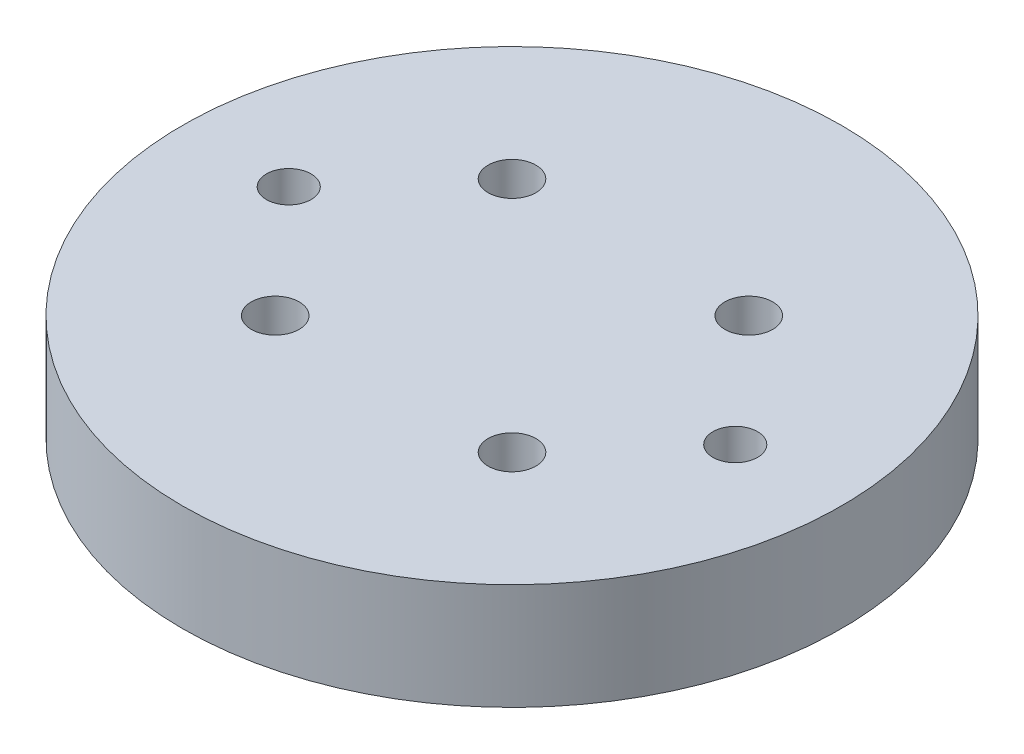
from build123d import *

# Parameters (mm, degrees)
SKETCH_1_R                = 31
EXTRUDE_1_DEPTH           = 10
HOLE_WIZARD_M5_2_D        = 4.2
HOLE_WIZARD_2_D           = 4.5
HOLE_WIZARD_2_CBORE_D     = 8
HOLE_WIZARD_2_CBORE_DEPTH = 4.6


with BuildPart() as part:
    # 草图1 → 凸台-拉伸1 (new body)
    with BuildSketch(Plane(origin=(0, 0, 0), x_dir=(1, 0, 0), z_dir=(0, 1, 0))):
        with Locations(Location((0, 0, 0), (0, 0, 270))):
            Circle(SKETCH_1_R)
    extrude(amount=EXTRUDE_1_DEPTH)

    # M5 螺纹孔2 (through all)
    with Locations(Plane(origin=(-21, 10, 0), x_dir=(0, 0, 1), z_dir=(0, 1, 0))):
        with Locations((0, 0), (0, 42)):
            Hole(HOLE_WIZARD_M5_2_D / 2)

    # 打孔尺寸(%根据)内六角圆柱头螺钉的类型2 (through all)
    with Locations(Plane(origin=(-11.136931804, 0, 11.136931804), x_dir=(0, 0, -1), z_dir=(0, -1, 0))):
        with Locations((0, 0), (0, 22.273863608), (22.273863608, 22.273863608), (22.273863608, 0)):
            CounterBoreHole(HOLE_WIZARD_2_D / 2, HOLE_WIZARD_2_CBORE_D / 2, HOLE_WIZARD_2_CBORE_DEPTH)


solid = part.part
